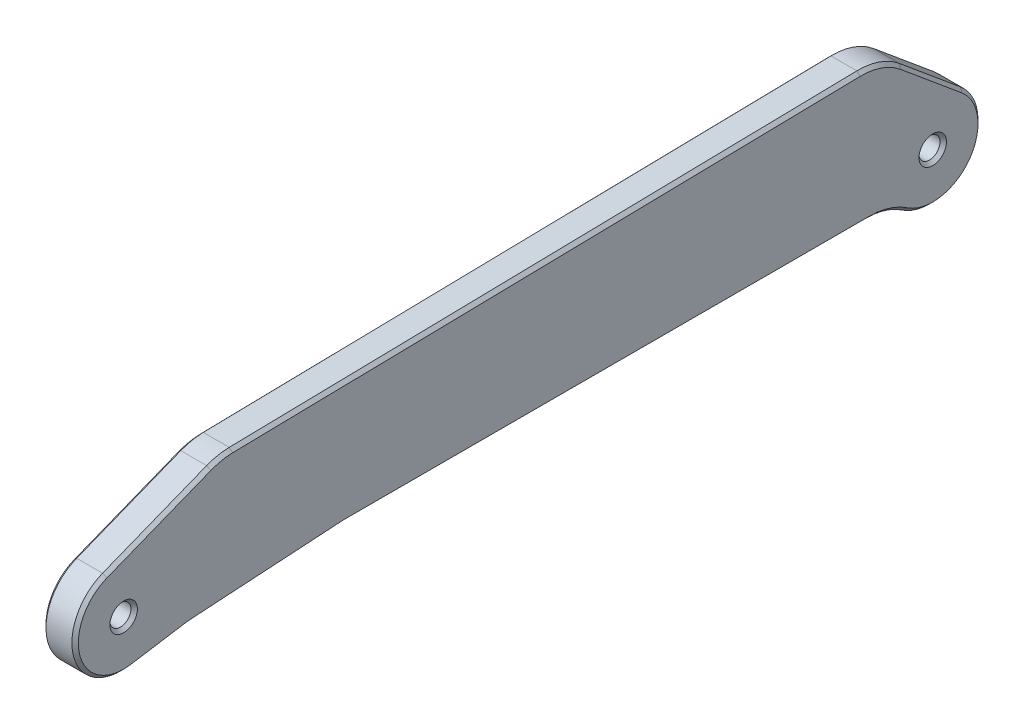
from build123d import *

# Parameters (mm, degrees)
SKETCH_1_R      = 1.625
SKETCH_1_R_2    = 1.575
EXTRUDE_1_DEPTH = 5
CHAMFER_1_SIZE  = 0.5
EXTRUDE_2_DEPTH = 5
EXTRUDE_3_DEPTH = 5


with BuildPart() as part:
    # 草图1 → 凸台-拉伸1 (new body)
    with BuildSketch(Plane(origin=(-2.5, 0, 0), x_dir=(0, -1, 0), z_dir=(-1, 0, 0))):
        with BuildLine():
            Line((-13.615329727, 4.634814191), (-5.764611689, -4.797838271))
            ThreePointArc((-5.764611689, -4.797838271), (4.504097017, -5.996925051), (6.214285714, 4.199125273))
            ThreePointArc((6.214285714, 4.199125273), (4.938171125, 6.870258752), (4.5, 9.797958971))
            Line((4.5, 9.797958971), (4.5, 90.687804581))
            ThreePointArc((4.5, 90.687804581), (4.50486974, 90.999847969), (4.519474215, 91.311587443))
            Line((4.519474215, 91.311587443), (5.970120756, 114.521932102))
            ThreePointArc((5.970120756, 114.521932102), (6.011395859, 114.998738119), (6.075436578, 115.473023263))
            Line((6.075436578, 115.473023263), (7.406407472, 123.818844483))
            ThreePointArc((7.406407472, 123.818844483), (1.981957648, 132.233383985), (-6.974045822, 127.759109434))
            Line((-6.974045822, 127.759109434), (-13.335850238, 111.678734019))
            ThreePointArc((-13.335850238, 111.678734019), (-13.841506721, 109.968181983), (-14.03521939, 108.195006258))
            Line((-14.03521939, 108.195006258), (-15.927277723, 11.227016703))
            ThreePointArc((-15.927277723, 11.227016703), (-15.365674922, 7.722463826), (-13.615329727, 4.634814191))
        make_face()
        with Locations(Location((0, 125, 0), (0, 0, 270))):
            Circle(SKETCH_1_R, mode=Mode.SUBTRACT)
        with Locations(Location((-8.5, 23.5, 0), (0, 0, 270))):
            Circle(SKETCH_1_R_2, mode=Mode.SUBTRACT)
        with Locations(Location((-5, 106.5, 0), (0, 0, 270))):
            Circle(SKETCH_1_R_2, mode=Mode.SUBTRACT)
        with Locations(Location((0, 0, 0), (0, 0, 270))):
            Circle(SKETCH_1_R, mode=Mode.SUBTRACT)
        with BuildLine():
            Line((-8.259933132, 32.545201991), (-6.991881816, 97.532831936))
            ThreePointArc((-6.991881816, 97.532831936), (-4.95324547, 99.493434355), (-2.992643051, 97.454798009))
            Line((-2.992643051, 97.454798009), (-4.260694367, 32.467168064))
            ThreePointArc((-4.260694367, 32.467168064), (-6.299330713, 30.506565645), (-8.259933132, 32.545201991))
        make_face(mode=Mode.SUBTRACT)
    extrude(amount=-EXTRUDE_1_DEPTH)

    # 倒角1
    chamfer_1_edges = [part.edges().sort_by_distance(p)[0] for p in [
        (2.5, -4.504097017, -5.996925051),
        (-2.5, 14.981248556, 59.71101148),
        (-2.5, 13.841506721, 109.968181983),
        (-2.5, 10.15494803, 119.718921727),
        (-2.5, -1.981957648, 132.233383985),
        (-2.5, -6.740922025, 119.645933873),
        (-2.5, -6.011395859, 114.998738119),
        (-2.5, -5.244797486, 102.916759772),
        (-2.5, -4.50486974, 90.999847969),
        (-2.5, -4.5, 50.242881776),
        (-2.5, -4.938171125, 6.870258752),
        (2.5, -4.938171125, 6.870258752),
        (-2.5, -4.504097017, -5.996925051),
        (-2.5, 9.689970708, -0.08151204),
        (-2.5, 15.365674922, 7.722463826),
        (2.5, -4.5, 50.242881776),
        (2.5, -4.50486974, 90.999847969),
        (2.5, -5.244797486, 102.916759772),
        (2.5, -6.011395859, 114.998738119),
        (2.5, 0, 126.625),
        (-2.5, 0, 126.625),
        (2.5, -6.740922025, 119.645933873),
        (2.5, 8.5, 25.075),
        (-2.5, 8.5, 25.075),
        (2.5, -1.981957648, 132.233383985),
        (2.5, 6.299330713, 30.506565645),
        (2.5, 7.625907474, 65.039016964),
        (2.5, 4.95324547, 99.493434355),
        (2.5, 3.626668709, 64.960983036),
        (2.5, 10.15494803, 119.718921727),
        (-2.5, 6.299330713, 30.506565645),
        (-2.5, 3.626668709, 64.960983036),
        (-2.5, 4.95324547, 99.493434355),
        (-2.5, 7.625907474, 65.039016964),
        (2.5, 13.841506721, 109.968181983),
        (2.5, 15.365674922, 7.722463826),
        (2.5, 14.981248556, 59.71101148),
        (2.5, 5, 108.075),
        (-2.5, 5, 108.075),
        (2.5, 0, 1.625),
        (-2.5, 0, 1.625),
        (2.5, 9.689970708, -0.08151204),
    ]]
    chamfer(chamfer_1_edges, length=CHAMFER_1_SIZE)

    # Sketch 3D_1 → 凸台-拉伸2 (add)
    with BuildSketch(Plane(origin=(2.5, -0.12857826, 115.032359126), x_dir=(0, -0.013604097539647628, -0.9999074599832386), z_dir=(1, 0, 0))):
        Polygon((0, 0), (96.922582011, 1.318666289), (96.940522936, 0), (0.017940925, -1.318666289), align=None)
    extrude(amount=-EXTRUDE_2_DEPTH)

    # Sketch 3D_2 → 凸台-拉伸3 (add)
    with BuildSketch(Plane(origin=(2.5, 7.131907218, 114.778535538), x_dir=(0, -0.036322969616865465, -0.9993401032072177), z_dir=(1, 0, 0))):
        Polygon((0, 0), (17.760330703, 3.73858914), (75.88295175, 7.788553229), (95.2811606, 9.140213698), (100.246342151, 0), (71.295283996, -6.76874803), (5.48633166, -7.137591509), align=None)
    extrude(amount=-EXTRUDE_3_DEPTH)


solid = part.part
